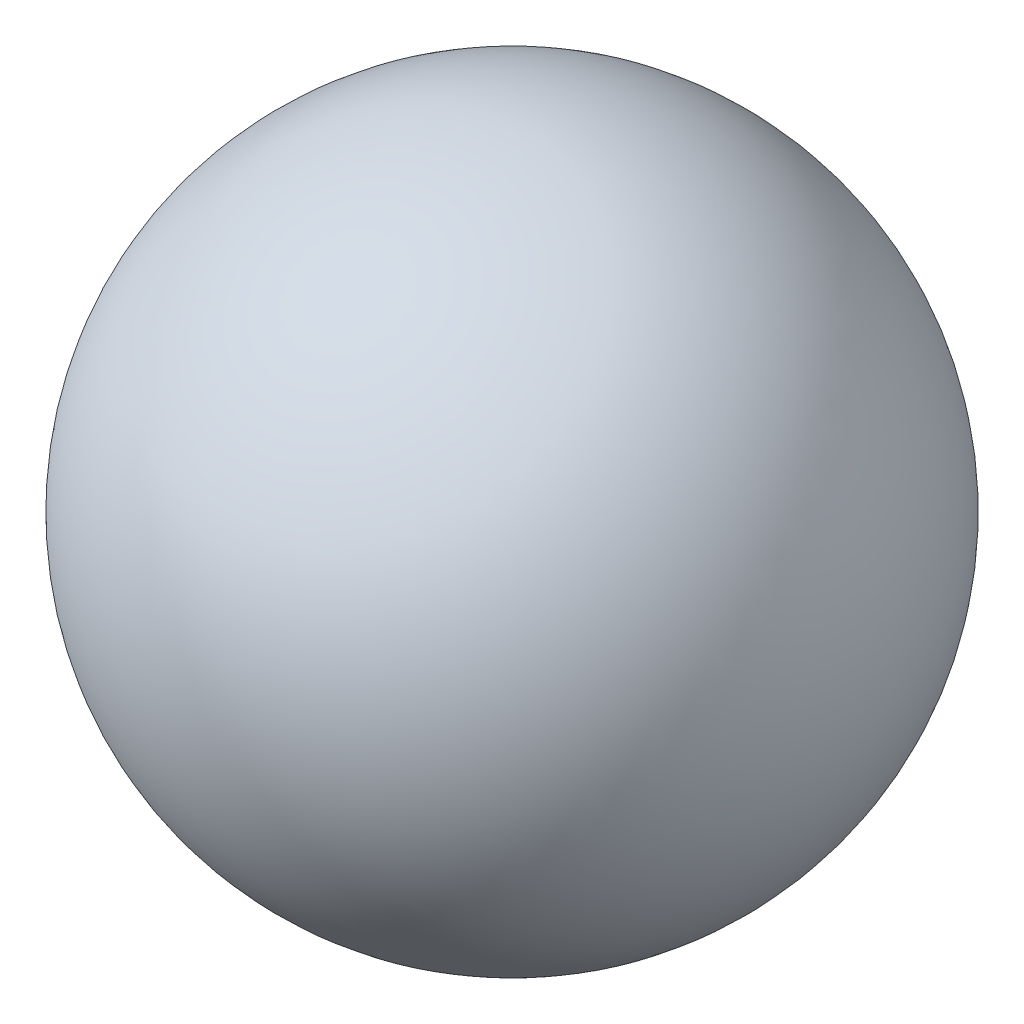
from build123d import *


with BuildPart() as part:
    # Sketch1 → Revolve2 (revolve)
    with BuildSketch(Plane.XY):
        with BuildLine():
            Line((0, 12.7), (0, -12.7))
            ThreePointArc((0, -12.7), (-12.7, 0), (0, 12.7))
        make_face()
    revolve(axis=Axis((0, 12.7, 0), (0, -1, 0)))


solid = part.part
